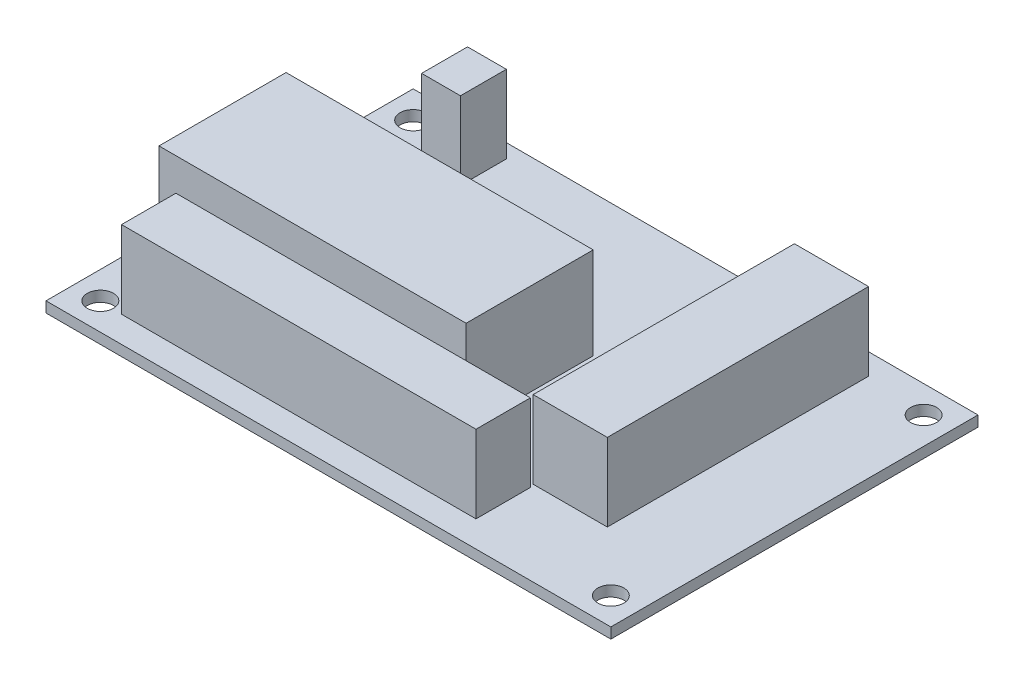
from build123d import *

# Parameters (mm, degrees)
SKETCH1_W           = 80
SKETCH1_H           = 52
SKETCH1_R           = 1.85
BOSS_EXTRUDE1_DEPTH = 1.5
SKETCH2_W           = 43.5
SKETCH2_H           = 18
BOSS_EXTRUDE2_DEPTH = 13
SKETCH3_W           = 10.5
SKETCH3_H           = 37
SKETCH3_W_2         = 50.2
SKETCH3_H_2         = 7.7
SKETCH3_W_3         = 5.5
SKETCH3_H_3         = 6.5
BOSS_EXTRUDE3_DEPTH = 11


with BuildPart() as part:
    # Sketch1 → Boss-Extrude1 (new body)
    with BuildSketch(Plane(origin=(0, 0, 0), x_dir=(1, 0, 0), z_dir=(0, 1, 0))):
        with Locations((40, 26)):
            Rectangle(SKETCH1_W, SKETCH1_H)
        with Locations(Location((3.85, 48.15, 0), (0, 0, 270))):
            Circle(SKETCH1_R, mode=Mode.SUBTRACT)
        with Locations(Location((3.85, 3.85, 0), (0, 0, 270))):
            Circle(SKETCH1_R, mode=Mode.SUBTRACT)
        with Locations(Location((76.15, 48.15, 0), (0, 0, 270))):
            Circle(SKETCH1_R, mode=Mode.SUBTRACT)
        with Locations(Location((76.15, 3.85, 0), (0, 0, 270))):
            Circle(SKETCH1_R, mode=Mode.SUBTRACT)
    extrude(amount=BOSS_EXTRUDE1_DEPTH)

    # Sketch2 → Boss-Extrude2 (add)
    with BuildSketch(Plane(origin=(0, 1.5, 0), x_dir=(1, 0, 0), z_dir=(0, 1, 0))):
        with Locations((23.75, 23)):
            Rectangle(SKETCH2_W, SKETCH2_H)
    extrude(amount=BOSS_EXTRUDE2_DEPTH)

    # Sketch3 → Boss-Extrude3 (add)
    with BuildSketch(Plane(origin=(0, 1.5, 0), x_dir=(1, 0, 0), z_dir=(0, 1, 0))):
        with Locations((62.25, 30.5)):
            Rectangle(SKETCH3_W, SKETCH3_H)
        with Locations((32.1, 7.55)):
            Rectangle(SKETCH3_W_2, SKETCH3_H_2)
        with Locations((12.45, 46.75)):
            Rectangle(SKETCH3_W_3, SKETCH3_H_3)
    extrude(amount=BOSS_EXTRUDE3_DEPTH)


solid = part.part
